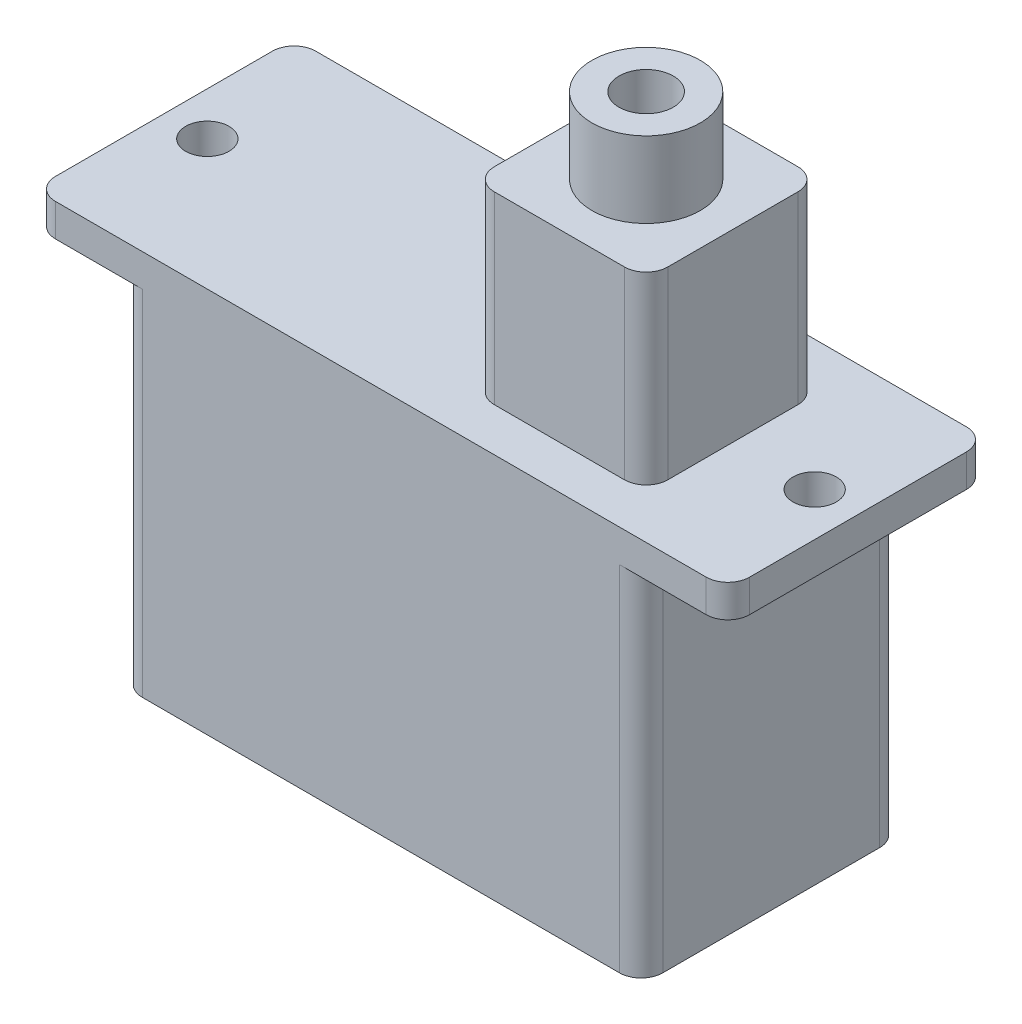
from build123d import *

# Parameters (mm, degrees)
SKETCH_1_W      = 24
SKETCH_1_H      = 12
EXTRUDE_1_DEPTH = 16.3
SKETCH_2_W      = 32
SKETCH_2_H      = 12
SKETCH_2_R      = 1
SKETCH_2_W_2    = 8
SKETCH_2_H_2    = 8
EXTRUDE_3_DEPTH = 1.5
SKETCH_2_4_W    = 8
SKETCH_2_4_H    = 8
EXTRUDE_4_DEPTH = 10
SKETCH_2_5_R    = 2.5
SKETCH_2_5_R_2  = 1.25
EXTRUDE_5_DEPTH = 13.5
FILLET_1_R      = 1
FILLET_2_R      = 1
FILLET_3_R      = 1


with BuildPart() as part:
    # 草图1 → 凸台-拉伸1 (new body)
    with BuildSketch(Plane(origin=(0, 0, 0), x_dir=(1, 0, 0), z_dir=(0, 1, 0))):
        Rectangle(SKETCH_1_W, SKETCH_1_H)
    extrude(amount=EXTRUDE_1_DEPTH)

    # 草图2 → 凸台-拉伸3 (add)
    with BuildSketch(Plane(origin=(0, 16.3, 0), x_dir=(1, 0, 0), z_dir=(0, 1, 0))):
        Rectangle(SKETCH_2_W, SKETCH_2_H)
        with Locations((-14, 0)):
            Circle(SKETCH_2_R, mode=Mode.SUBTRACT)
        with Locations((6.23, 0)):
            Rectangle(SKETCH_2_W_2, SKETCH_2_H_2, mode=Mode.SUBTRACT)
        with Locations((14, 0)):
            Circle(SKETCH_2_R, mode=Mode.SUBTRACT)
    extrude(amount=EXTRUDE_3_DEPTH)

    # 草图2<4> → 凸台-拉伸4 (add)
    with BuildSketch(Plane(origin=(0, 16.3, 0), x_dir=(1, 0, 0), z_dir=(0, 1, 0))):
        with Locations((6.23, 0)):
            Rectangle(SKETCH_2_4_W, SKETCH_2_4_H)
    extrude(amount=EXTRUDE_4_DEPTH)

    # 草图2<5> → 凸台-拉伸5 (add)
    with BuildSketch(Plane(origin=(0, 16.3, 0), x_dir=(1, 0, 0), z_dir=(0, 1, 0))):
        with Locations((6.23, 0)):
            Circle(SKETCH_2_5_R)
        with Locations((6.23, 0)):
            Circle(SKETCH_2_5_R_2, mode=Mode.SUBTRACT)
    extrude(amount=EXTRUDE_5_DEPTH)

    # 圆角1
    fillet_1_edges = [part.edges().sort_by_distance(p)[0] for p in [
        (16, 17.05, -6),
        (16, 17.05, 6),
        (-16, 17.05, -6),
        (-16, 17.05, 6),
    ]]
    fillet(fillet_1_edges, radius=FILLET_1_R)

    # 圆角2
    fillet_2_edges = [part.edges().sort_by_distance(p)[0] for p in [
        (10.23, 22.05, -4),
        (2.23, 22.05, -4),
        (2.23, 22.05, 4),
        (10.23, 22.05, 4),
    ]]
    fillet(fillet_2_edges, radius=FILLET_2_R)

    # 圆角3
    fillet_3_edges = [part.edges().sort_by_distance(p)[0] for p in [
        (-12, 8.15, -6),
        (-12, 8.15, 6),
        (12, 8.15, -6),
        (12, 8.15, 6),
    ]]
    fillet(fillet_3_edges, radius=FILLET_3_R)


solid = part.part
